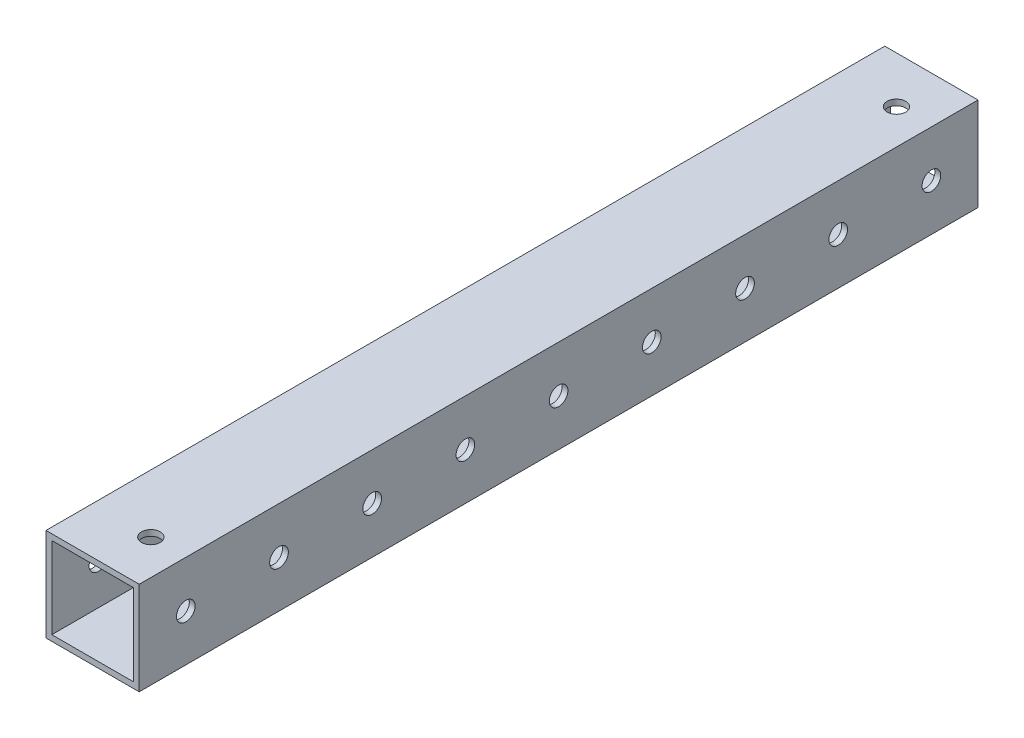
from build123d import *

# Parameters (mm, degrees)
SKETCH1_W           = 25.4
SKETCH1_H           = 25.4
SKETCH1_W_2         = 22.225
SKETCH1_H_2         = 22.225
BOSS_EXTRUDE1_DEPTH = 228.6
SKETCH3_R           = 2.54
CUT_EXTRUDE2_DEPTH  = 232.40501291
SKETCH4_R           = 2.54
CUT_EXTRUDE3_DEPTH  = 232.40501291


with BuildPart() as part:
    # Sketch1 → Boss-Extrude1 (new body)
    with BuildSketch(Plane.XY):
        with Locations((12.7, 12.7)):
            Rectangle(SKETCH1_W, SKETCH1_H)
        with Locations((12.7, 12.7)):
            Rectangle(SKETCH1_W_2, SKETCH1_H_2, mode=Mode.SUBTRACT)
    extrude(amount=BOSS_EXTRUDE1_DEPTH)

    # Sketch3 → Cut-Extrude2 (cut, through all)
    with BuildSketch(Plane(origin=(0, 25.4, 0), x_dir=(1, 0, 0), z_dir=(0, 1, 0))):
        with Locations(Location((15.875, -215.9, 0), (0, 0, 270))):
            Circle(SKETCH3_R)
        with Locations(Location((15.875, -12.7, 0), (0, 0, 270))):
            Circle(SKETCH3_R)
    extrude(amount=-CUT_EXTRUDE2_DEPTH, mode=Mode.SUBTRACT)

    # Sketch4 → Cut-Extrude3 (cut, through all)
    with BuildSketch(Plane(origin=(25.4, 0, 0), x_dir=(0, 0, -1), z_dir=(1, 0, 0))):
        with Locations((-215.9, 12.7)):
            Circle(SKETCH4_R)
        with Locations((-190.5, 12.7)):
            Circle(SKETCH4_R)
        with Locations((-165.1, 12.7)):
            Circle(SKETCH4_R)
        with Locations((-139.7, 12.7)):
            Circle(SKETCH4_R)
        with Locations((-114.3, 12.7)):
            Circle(SKETCH4_R)
        with Locations((-88.9, 12.7)):
            Circle(SKETCH4_R)
        with Locations((-63.5, 12.7)):
            Circle(SKETCH4_R)
        with Locations((-38.1, 12.7)):
            Circle(SKETCH4_R)
        with Locations((-12.7, 12.7)):
            Circle(SKETCH4_R)
    extrude(amount=-CUT_EXTRUDE3_DEPTH, mode=Mode.SUBTRACT)


solid = part.part
